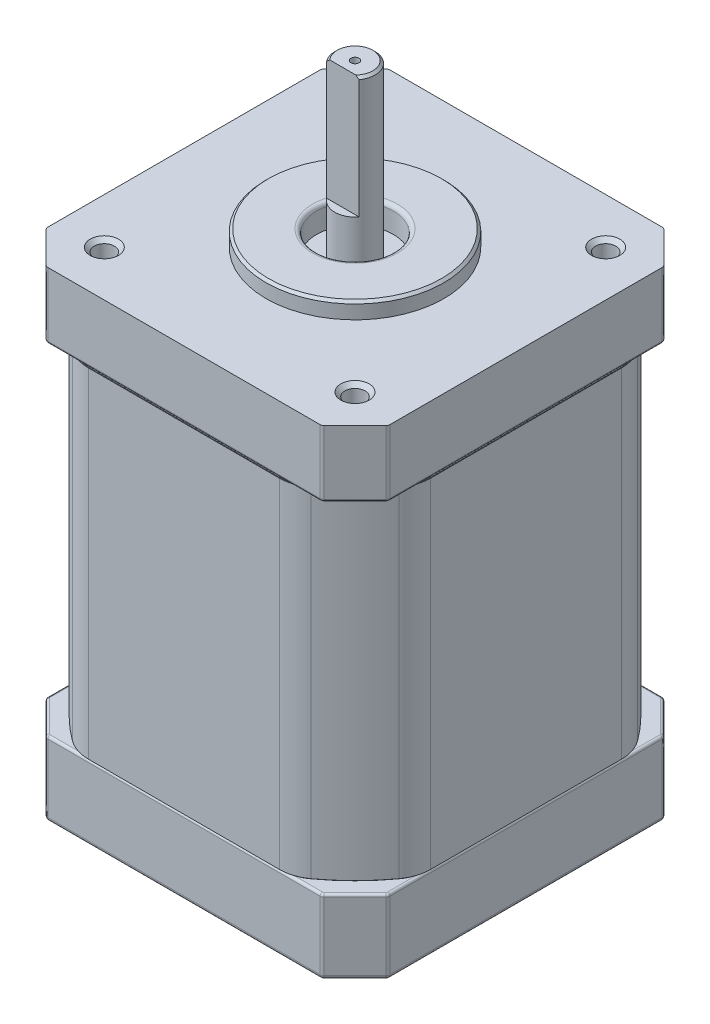
from build123d import *

# Parameters (mm, degrees)
EXTRUDE_1_DEPTH      = 9.2
EXTRUDE_START        = 59.4
EXTRUDE_2_DEPTH      = 8.2
EXTRUDE_3_DEPTH      = 42
FILLET_1_R           = 0.5
FILLET_2_R           = 0.5
SKETCH_6_R           = 11
SKETCH_6_R_2         = 4.75
EXTRUDE_4_DEPTH      = 2
SKETCH_7_R           = 4.75
CUT_EXTRUDE_4_DEPTH  = 1
CHAMFER_2_SIZE       = 0.3
FILLET_3_R           = 0.5
SKETCH_8_R           = 2.5
EXTRUDE_5_DEPTH      = 21
CHAMFER_4_SIZE       = 0.3
SKETCH_9_R           = 0.5
CUT_EXTRUDE_5_DEPTH  = 1
CHAMFER_34_SIZE      = 0.05
SKETCH_16_R          = 1.25
CUT_EXTRUDE_9_DEPTH  = 7
CHAMFER_35_SIZE      = 0.5
FILLET_4_R           = 0.3
FILLET_5_R           = 0.3
SKETCH_17_W          = 5
SKETCH_17_H          = 1.5
CUT_EXTRUDE_10_DEPTH = 15


with BuildPart() as part:
    # Эскиз1 → Бобышка-Вытянуть1 (new body)
    with BuildSketch(Plane(origin=(0, 0, 0), x_dir=(1, 0, 0), z_dir=(0, 1, 0))):
        Polygon((-17.033766184, 21.15), (-21.15, 17.033766184), (-21.15, -17.033766184), (-17.033766184, -21.15), (17.033766184, -21.15), (21.15, -17.033766184), (21.15, 17.033766184), (17.033766184, 21.15), align=None)
    extrude(amount=EXTRUDE_1_DEPTH)

    # Скругление1
    fillet_1_edges = [part.edges().sort_by_distance(p)[0] for p in [
        (0, 0, 21.15),
        (19.091883092, 0, 19.091883092),
        (21.15, 0, 0),
        (19.091883092, 0, -19.091883092),
        (0, 0, -21.15),
        (-19.091883092, 0, -19.091883092),
        (-21.15, 0, 0),
        (-19.091883092, 0, 19.091883092),
        (21.15, 4.6, 17.033766184),
        (17.033766184, 4.6, 21.15),
        (-17.033766184, 4.6, 21.15),
        (-21.15, 4.6, 17.033766184),
        (-21.15, 4.6, -17.033766184),
        (-17.033766184, 4.6, -21.15),
        (17.033766184, 4.6, -21.15),
        (21.15, 4.6, -17.033766184),
    ]]
    fillet(fillet_1_edges, radius=FILLET_1_R)

    # Скругление4
    fillet_4_edges = [part.edges().sort_by_distance(p)[0] for p in [
        (0, 9.2, 21.15),
        (-17.018001119, 9.2, 21.111939766),
        (-19.091883092, 9.2, 19.091883092),
        (-21.111939766, 9.2, 17.018001119),
        (-21.15, 9.2, 0),
        (-21.111939766, 9.2, -17.018001119),
        (-19.091883092, 9.2, -19.091883092),
        (-17.018001119, 9.2, -21.111939766),
        (0, 9.2, -21.15),
        (17.018001119, 9.2, -21.111939766),
        (19.091883092, 9.2, -19.091883092),
        (21.111939766, 9.2, -17.018001119),
        (21.15, 9.2, 0),
        (21.111939766, 9.2, 17.018001119),
        (17.018001119, 9.2, 21.111939766),
        (19.091883092, 9.2, 19.091883092),
    ]]
    fillet(fillet_4_edges, radius=FILLET_4_R)


with BuildPart() as body_2:
    # Эскиз1<3> → Бобышка-Вытянуть2 (new body)
    with BuildSketch(Plane(origin=(0, 0, 0), x_dir=(1, 0, 0), z_dir=(0, 1, 0)).offset(EXTRUDE_START)):
        Polygon((-17.033766184, 21.15), (-21.15, 17.033766184), (-21.15, -17.033766184), (-17.033766184, -21.15), (17.033766184, -21.15), (21.15, -17.033766184), (21.15, 17.033766184), (17.033766184, 21.15), align=None)
    extrude(amount=-EXTRUDE_2_DEPTH)

    # Скругление2
    fillet_2_edges = [body_2.edges().sort_by_distance(p)[0] for p in [
        (21.15, 55.3, 17.033766184),
        (17.033766184, 55.3, 21.15),
        (-17.033766184, 55.3, 21.15),
        (-21.15, 55.3, 17.033766184),
        (-21.15, 55.3, -17.033766184),
        (-17.033766184, 55.3, -21.15),
        (17.033766184, 55.3, -21.15),
        (21.15, 55.3, -17.033766184),
    ]]
    fillet(fillet_2_edges, radius=FILLET_2_R)

    # Эскиз6 → Бобышка-Вытянуть4 (add)
    with BuildSketch(Plane(origin=(0, 59.4, 0), x_dir=(1, 0, 0), z_dir=(0, 1, 0))):
        Circle(SKETCH_6_R)
        Circle(SKETCH_6_R_2, mode=Mode.SUBTRACT)
    extrude(amount=EXTRUDE_4_DEPTH)

    # Эскиз7 → Вырез-Вытянуть4 (cut)
    with BuildSketch(Plane(origin=(0, 59.4, 0), x_dir=(1, 0, 0), z_dir=(0, 1, 0))):
        Circle(SKETCH_7_R)
    extrude(amount=-CUT_EXTRUDE_4_DEPTH, mode=Mode.SUBTRACT)

    # Фаска2
    chamfer_2_edges = [body_2.edges().sort_by_distance(p)[0] for p in [
        (-11, 61.4, 0),
    ]]
    chamfer(chamfer_2_edges, length=CHAMFER_2_SIZE)

    # Скругление3
    fillet_3_edges = [body_2.edges().sort_by_distance(p)[0] for p in [
        (-4.75, 61.4, 0),
    ]]
    fillet(fillet_3_edges, radius=FILLET_3_R)

    # Эскиз8 → Бобышка-Вытянуть5 (add)
    with BuildSketch(Plane(origin=(0, 58.4, 0), x_dir=(1, 0, 0), z_dir=(0, 1, 0))):
        Circle(SKETCH_8_R)
    extrude(amount=EXTRUDE_5_DEPTH)

    # Фаска4
    chamfer_4_edges = [body_2.edges().sort_by_distance(p)[0] for p in [
        (-2.5, 79.4, 0),
    ]]
    chamfer(chamfer_4_edges, length=CHAMFER_4_SIZE)

    # Эскиз9 → Вырез-Вытянуть5 (cut)
    with BuildSketch(Plane(origin=(0, 79.4, 0), x_dir=(1, 0, 0), z_dir=(0, 1, 0))):
        Circle(SKETCH_9_R)
    extrude(amount=-CUT_EXTRUDE_5_DEPTH, mode=Mode.SUBTRACT)

    # Эскиз16 → Вырез-Вытянуть9 (cut)
    with BuildSketch(Plane(origin=(0, 59.4, 0), x_dir=(1, 0, 0), z_dir=(0, 1, 0))):
        with Locations((-15.5, 15.5)):
            Circle(SKETCH_16_R)
        with Locations((15.5, 15.5)):
            Circle(SKETCH_16_R)
        with Locations((15.5, -15.5)):
            Circle(SKETCH_16_R)
        with Locations((-15.5, -15.5)):
            Circle(SKETCH_16_R)
    extrude(amount=-CUT_EXTRUDE_9_DEPTH, mode=Mode.SUBTRACT)

    # Фаска35
    chamfer_35_edges = [body_2.edges().sort_by_distance(p)[0] for p in [
        (-16.75, 59.4, 15.5),
        (14.25, 59.4, 15.5),
        (14.25, 59.4, -15.5),
        (-16.75, 59.4, -15.5),
    ]]
    chamfer(chamfer_35_edges, length=CHAMFER_35_SIZE)

    # Скругление5
    fillet_5_edges = [body_2.edges().sort_by_distance(p)[0] for p in [
        (21.111939766, 51.2, 17.018001119),
        (21.15, 51.2, 0),
        (21.111939766, 51.2, -17.018001119),
        (19.091883092, 51.2, -19.091883092),
        (17.018001119, 51.2, -21.111939766),
        (0, 51.2, -21.15),
        (-17.018001119, 51.2, -21.111939766),
        (-19.091883092, 51.2, -19.091883092),
        (-21.111939766, 51.2, -17.018001119),
        (-21.15, 51.2, 0),
        (-21.111939766, 51.2, 17.018001119),
        (-19.091883092, 51.2, 19.091883092),
        (-17.018001119, 51.2, 21.111939766),
        (0, 51.2, 21.15),
        (17.018001119, 51.2, 21.111939766),
        (19.091883092, 51.2, 19.091883092),
    ]]
    fillet(fillet_5_edges, radius=FILLET_5_R)

    # Эскиз17 → Вырез-Вытянуть10 (cut)
    with BuildSketch(Plane(origin=(0, 79.4, 0), x_dir=(1, 0, 0), z_dir=(0, 1, 0))):
        with Locations((0, -2.25)):
            Rectangle(SKETCH_17_W, SKETCH_17_H)
    extrude(amount=-CUT_EXTRUDE_10_DEPTH, mode=Mode.SUBTRACT)


with BuildPart() as body_3:
    # Эскиз2 → Бобышка-Вытянуть3 (new body)
    with BuildSketch(Plane(origin=(0, 9.2, 0), x_dir=(1, 0, 0), z_dir=(0, 1, 0))):
        with BuildLine():
            Line((-11.797351398, -21.15), (11.797351398, -21.15))
            ThreePointArc((11.797351398, -21.15), (13.348560603, -20.903288335), (14.746689247, -20.1875))
            ThreePointArc((14.746689247, -20.1875), (17.67766953, -17.67766953), (20.1875, -14.746689247))
            ThreePointArc((20.1875, -14.746689247), (20.903288335, -13.348560603), (21.15, -11.797351398))
            Line((21.15, -11.797351398), (21.15, 11.797351398))
            ThreePointArc((21.15, 11.797351398), (20.903288335, 13.348560603), (20.1875, 14.746689247))
            ThreePointArc((20.1875, 14.746689247), (17.67766953, 17.67766953), (14.746689247, 20.1875))
            ThreePointArc((14.746689247, 20.1875), (13.348560603, 20.903288335), (11.797351398, 21.15))
            Line((11.797351398, 21.15), (-11.797351398, 21.15))
            ThreePointArc((-11.797351398, 21.15), (-13.348560603, 20.903288335), (-14.746689247, 20.1875))
            ThreePointArc((-14.746689247, 20.1875), (-17.67766953, 17.67766953), (-20.1875, 14.746689247))
            ThreePointArc((-20.1875, 14.746689247), (-20.903288335, 13.348560603), (-21.15, 11.797351398))
            Line((-21.15, 11.797351398), (-21.15, -11.797351398))
            ThreePointArc((-21.15, -11.797351398), (-20.903288335, -13.348560603), (-20.1875, -14.746689247))
            ThreePointArc((-20.1875, -14.746689247), (-17.67766953, -17.67766953), (-14.746689247, -20.1875))
            ThreePointArc((-14.746689247, -20.1875), (-13.348560603, -20.903288335), (-11.797351398, -21.15))
        make_face()
    extrude(amount=EXTRUDE_3_DEPTH)

    # Фаска34
    chamfer_34_edges = [body_3.edges().sort_by_distance(p)[0] for p in [
        (-17.67766953, 51.2, -17.67766953),
        (-20.903288335, 51.2, -13.348560603),
        (-13.348560603, 51.2, -20.903288335),
        (-21.15, 51.2, 0),
        (0, 51.2, -21.15),
        (-20.903288335, 51.2, 13.348560603),
        (13.348560603, 51.2, -20.903288335),
        (-17.67766953, 51.2, 17.67766953),
        (17.67766953, 51.2, -17.67766953),
        (-13.348560603, 51.2, 20.903288335),
        (20.903288335, 51.2, -13.348560603),
        (0, 51.2, 21.15),
        (21.15, 51.2, 0),
        (13.348560603, 51.2, 20.903288335),
        (20.903288335, 51.2, 13.348560603),
        (17.67766953, 51.2, 17.67766953),
        (-17.67766953, 9.2, -17.67766953),
        (-20.903288335, 9.2, -13.348560603),
        (-13.348560603, 9.2, -20.903288335),
        (-21.15, 9.2, 0),
        (0, 9.2, -21.15),
        (-20.903288335, 9.2, 13.348560603),
        (13.348560603, 9.2, -20.903288335),
        (-17.67766953, 9.2, 17.67766953),
        (17.67766953, 9.2, -17.67766953),
        (-13.348560603, 9.2, 20.903288335),
        (20.903288335, 9.2, -13.348560603),
        (0, 9.2, 21.15),
        (21.15, 9.2, 0),
        (13.348560603, 9.2, 20.903288335),
        (20.903288335, 9.2, 13.348560603),
        (17.67766953, 9.2, 17.67766953),
    ]]
    chamfer(chamfer_34_edges, length=CHAMFER_34_SIZE)


solid = Compound([part.part, body_2.part, body_3.part])
